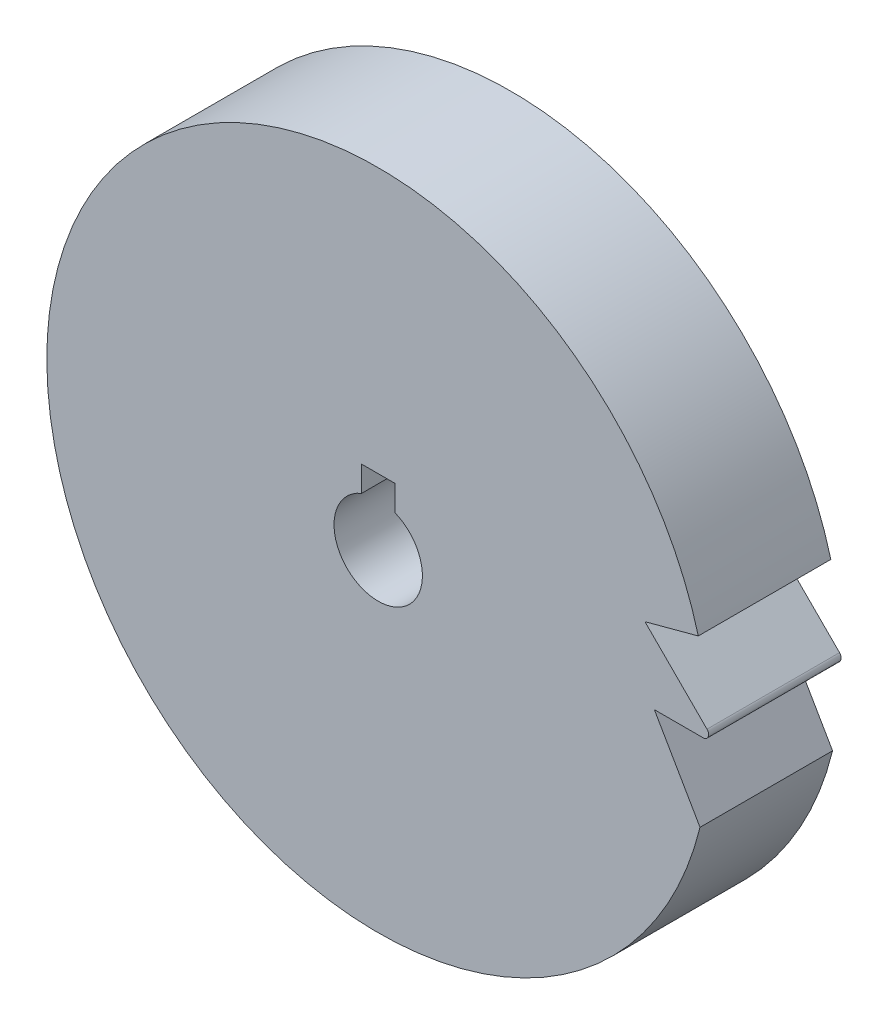
from build123d import *

# Parameters (mm, degrees)
SKETCH1_R          = 30
EXTRUDE1_DEPTH     = 12
CUT_EXTRUDE1_DEPTH = 12


with BuildPart() as part:
    # Sketch1 → Extrude1 (new body)
    with BuildSketch(Plane.XY):
        Circle(SKETCH1_R)
        with BuildLine():
            Line((-1.5, 6), (1.5, 6))
            Line((1.5, 6), (1.5, 3.708099244))
            ThreePointArc((1.5, 3.708099244), (0, -4), (-1.5, 3.708099244))
            Line((-1.5, 3.708099244), (-1.5, 6))
        make_face(mode=Mode.SUBTRACT)
    extrude(amount=EXTRUDE1_DEPTH)

    # Sketch2 → Cut-Extrude1 (cut)
    with BuildSketch(Plane.XY.offset(12)):
        with BuildLine():
            Line((25, 0), (29.411515004, 0))
            ThreePointArc((29.411515004, 0), (29.87345477, 0.308658284), (29.765068394, 0.853553391))
            Line((29.765068394, 0.853553391), (24.148145657, 6.470476128))
            Line((24.148145657, 6.470476128), (34.591694707, 9.268816662))
            Line((34.591694707, 9.268816662), (29.575317547, -7.924682453))
            Line((29.575317547, -7.924682453), (25, 0))
        make_face()
    extrude(amount=-CUT_EXTRUDE1_DEPTH, mode=Mode.SUBTRACT)


solid = part.part
